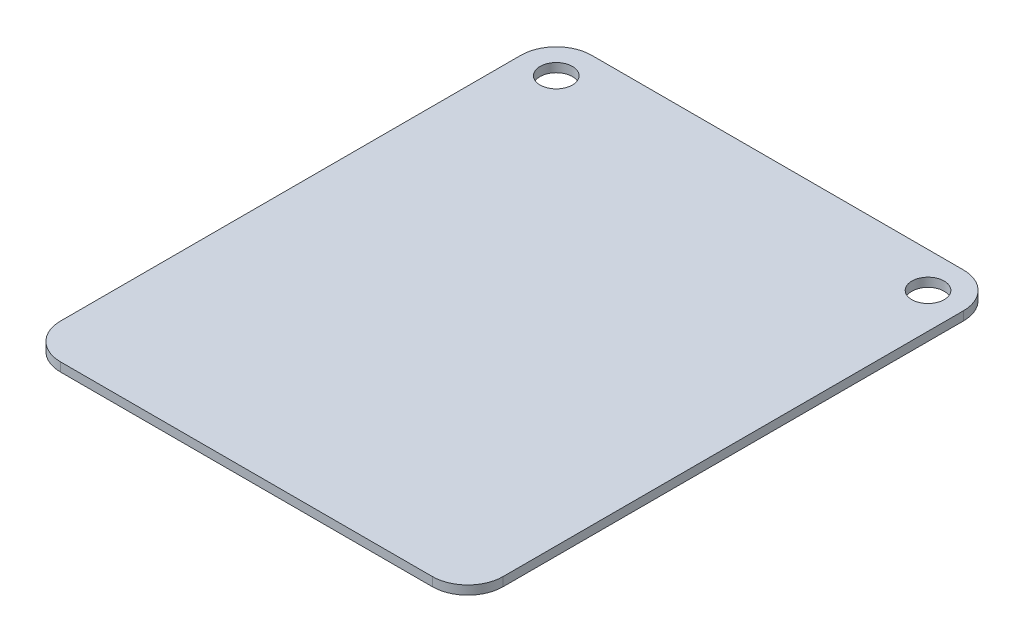
from build123d import *

# Parameters (mm, degrees)
SKETCH1_R           = 1.825
BOSS_EXTRUDE1_DEPTH = 1


with BuildPart() as part:
    # Sketch1 → Boss-Extrude1 (new body)
    with BuildSketch(Plane(origin=(0, 0, 0), x_dir=(1, 0, 0), z_dir=(0, 1, 0))):
        with BuildLine():
            Line((-21, 30), (21, 30))
            ThreePointArc((21, 30), (23.828427125, 28.828427125), (25, 26))
            Line((25, 26), (25, -26))
            ThreePointArc((25, -26), (23.828427125, -28.828427125), (21, -30))
            Line((21, -30), (-21, -30))
            ThreePointArc((-21, -30), (-23.828427125, -28.828427125), (-25, -26))
            Line((-25, -26), (-25, 26))
            ThreePointArc((-25, 26), (-23.828427125, 28.828427125), (-21, 30))
        make_face()
        with Locations(Location((-21, 26, 0), (0, 0, 270))):
            Circle(SKETCH1_R, mode=Mode.SUBTRACT)
        with Locations(Location((21, 26, 0), (0, 0, 90))):
            Circle(SKETCH1_R, mode=Mode.SUBTRACT)
    extrude(amount=BOSS_EXTRUDE1_DEPTH)


solid = part.part
